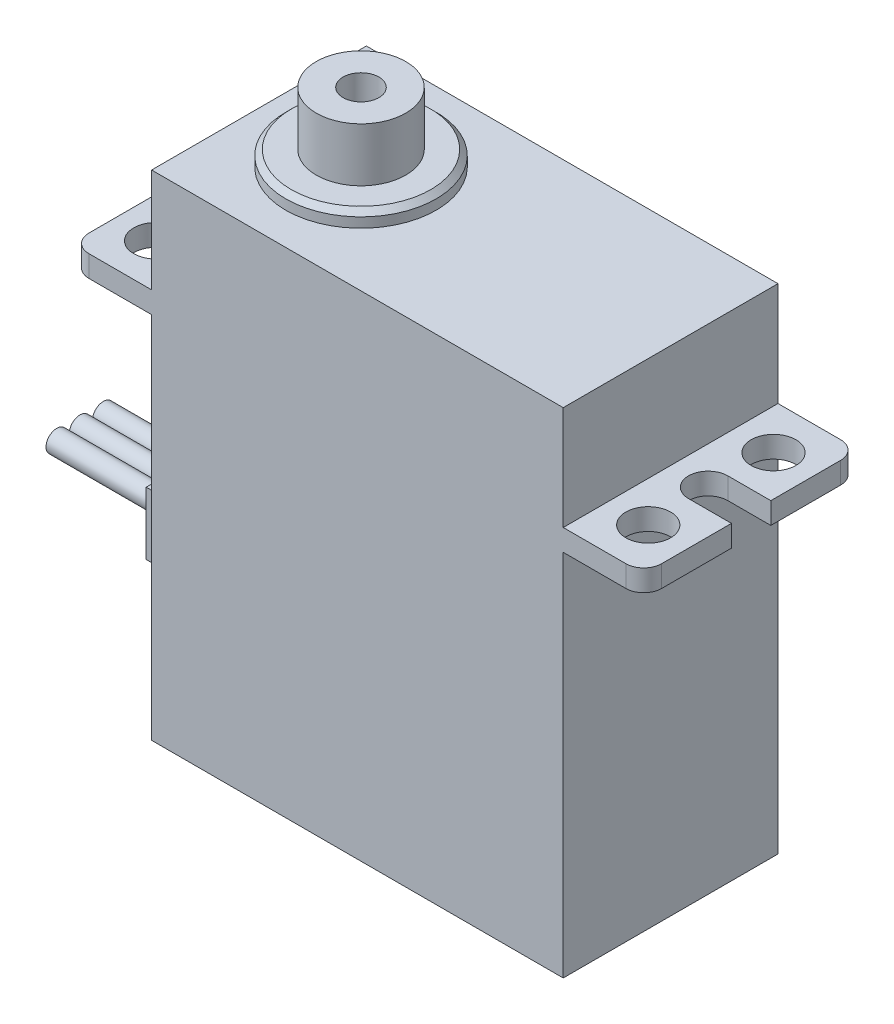
from build123d import *

# Parameters (mm, degrees)
SKETCH_1_W               = 23
SKETCH_1_H               = 27.6
SKETCH_1_W_2             = 4.5
SKETCH_1_H_2             = 1.2
EXTRUDE_1_DEPTH          = 6
SKETCH_2_R               = 4.2
EXTRUDE_2_DEPTH          = 0.85
CHAMFER_1_SIZE           = 0.3
SKETCH_4_R               = 2.5
SKETCH_4_R_2             = 1
EXTRUDE_3_DEPTH          = 3
CUT_EXTRUDE_1_DEPTH      = 28.699097458
CUT_EXTRUDE_1_DEPTH_BACK = 28.699097458
SKETCH_3_R               = 1.25
FILLET_1_R               = 1
SKETCH_5_W               = 5.6
SKETCH_5_H               = 3.5
EXTRUDE_4_DEPTH          = 3.5
SKETCH_6_R               = 0.6
EXTRUDE_7_DEPTH          = 6.5


with BuildPart() as part:
    # Эскиз1 → Бобышка-Вытянуть1 (new, symmetric)
    with BuildSketch(Plane.XY):
        Rectangle(SKETCH_1_W, SKETCH_1_H)
        with Locations((-13.75, 7.4)):
            Rectangle(SKETCH_1_W_2, SKETCH_1_H_2)
        with Locations((13.75, 7.4)):
            Rectangle(SKETCH_1_W_2, SKETCH_1_H_2)
    extrude(amount=EXTRUDE_1_DEPTH, both=True)

    # Эскиз2 → Бобышка-Вытянуть2 (add)
    with BuildSketch(Plane(origin=(0, 13.8, 0), x_dir=(1, 0, 0), z_dir=(0, 1, 0))):
        with Locations(Location((-5.8, 0, 0), (0, 0, 270))):
            Circle(SKETCH_2_R)
    extrude(amount=EXTRUDE_2_DEPTH)

    # Фаска1
    chamfer_1_edges = [part.edges().sort_by_distance(p)[0] for p in [
        (-5.8, 14.65, -4.2),
    ]]
    chamfer(chamfer_1_edges, length=CHAMFER_1_SIZE)

    # Эскиз4 → Бобышка-Вытянуть3 (add)
    with BuildSketch(Plane(origin=(0, 14.65, 0), x_dir=(1, 0, 0), z_dir=(0, 1, 0))):
        with Locations(Location((-5.8, 0, 0), (0, 0, 270))):
            Circle(SKETCH_4_R)
        with Locations(Location((-5.8, 0, 0), (0, 0, 270))):
            Circle(SKETCH_4_R_2, mode=Mode.SUBTRACT)
    extrude(amount=EXTRUDE_3_DEPTH)

    # Эскиз3 → Вырез-Вытянуть1 (cut, two sides: drawn at the far end of the back side and taken through both)
    with BuildSketch(Plane(origin=(0, 8, 0), x_dir=(1, 0, 0), z_dir=(0, 1, 0)).offset(-CUT_EXTRUDE_1_DEPTH_BACK)):
        with Locations(Location((-13.75, 3.5, 0), (0, 0, 270))):
            Circle(SKETCH_3_R)
        with Locations(Location((-13.75, -3.5, 0), (0, 0, 270))):
            Circle(SKETCH_3_R)
        with Locations(Location((13.75, -3.5, 0), (0, 0, 90))):
            Circle(SKETCH_3_R)
        with Locations(Location((13.75, 3.5, 0), (0, 0, 90))):
            Circle(SKETCH_3_R)
        with BuildLine():
            Line((-16, 1.1), (-13.6, 1.1))
            ThreePointArc((-13.6, 1.1), (-12.5, 0), (-13.6, -1.1))
            Line((-13.6, -1.1), (-16, -1.1))
            Line((-16, -1.1), (-16, 1.1))
        make_face()
        with BuildLine():
            Line((16, 1.1), (13.6, 1.1))
            ThreePointArc((13.6, 1.1), (12.5, 0), (13.6, -1.1))
            Line((13.6, -1.1), (16, -1.1))
            Line((16, -1.1), (16, 1.1))
        make_face()
    extrude(amount=CUT_EXTRUDE_1_DEPTH + CUT_EXTRUDE_1_DEPTH_BACK, mode=Mode.SUBTRACT)

    # Скругление1
    fillet_1_edges = [part.edges().sort_by_distance(p)[0] for p in [
        (-16, 7.4, -6),
        (16, 7.4, -6),
        (16, 7.4, 6),
        (-16, 7.4, 6),
    ]]
    fillet(fillet_1_edges, radius=FILLET_1_R)

    # Эскиз5 → Бобышка-Вытянуть4 (add)
    with BuildSketch(Plane.ZY.offset(11.5)):
        with Locations((0, -6.65)):
            Rectangle(SKETCH_5_W, SKETCH_5_H)
    extrude(amount=EXTRUDE_4_DEPTH)

    # Эскиз6 → Бобышка-Вытянуть7 (add)
    with BuildSketch(Plane.ZY.offset(15)):
        with Locations((0, -6.65)):
            Circle(SKETCH_6_R)
        with Locations(Location((1.3, -6.65, 0), (0, 0, 180))):
            Circle(SKETCH_6_R)
        with Locations(Location((-1.3, -6.65, 0), (0, 0, 180))):
            Circle(SKETCH_6_R)
    extrude(amount=EXTRUDE_7_DEPTH)


solid = part.part
